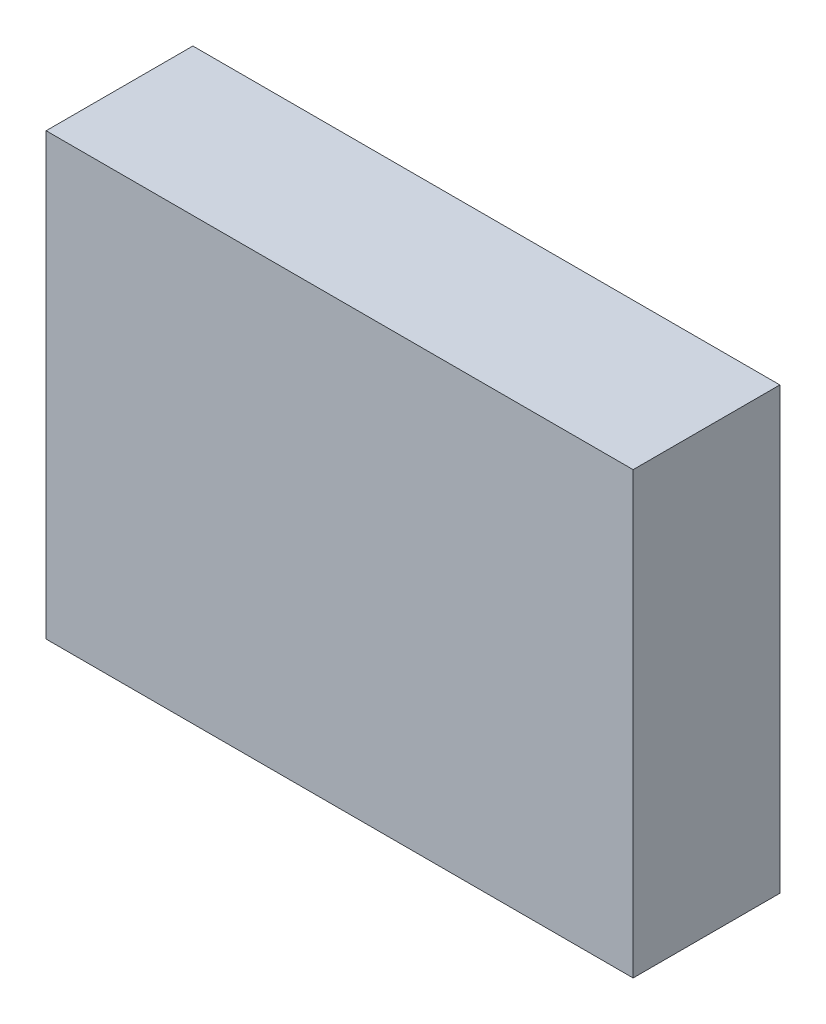
from build123d import *

# Parameters (mm, degrees)
BOSS_EXTRUDE2_DEPTH             = 60
BOSS_EXTRUDE2_DEPTH_BACK        = 60
SKETCH1_W                       = 90
SKETCH1_H                       = 30
F_2_0MM_DOWEL_HOLE1_D           = 2
F_2_0MM_DOWEL_HOLE1_DEPTH       = 10
F_2_0MM_DOWEL_HOLE1_CSINK_D     = 2.05
F_2_0MM_DOWEL_HOLE1_CSINK_ANGLE = 90
F_2_0MM_DOWEL_HOLE1_TIP         = 0.600860619
F_2_0MM_DOWEL_HOLE2_D           = 2
F_2_0MM_DOWEL_HOLE2_DEPTH       = 10
F_2_0MM_DOWEL_HOLE2_CSINK_D     = 2.05
F_2_0MM_DOWEL_HOLE2_CSINK_ANGLE = 90
F_2_0MM_DOWEL_HOLE2_TIP         = 0.600860619


with BuildPart() as part:
    # Sketch1 → Boss-Extrude2 (new, two sides: drawn at the far end of the back side and taken through both)
    with BuildSketch(Plane.YZ.offset(-BOSS_EXTRUDE2_DEPTH_BACK)):
        with Locations((-45, 15)):
            Rectangle(SKETCH1_W, SKETCH1_H)
    extrude(amount=BOSS_EXTRUDE2_DEPTH + BOSS_EXTRUDE2_DEPTH_BACK)

    # Ø2.0mm Dowel Hole1
    with Locations(Plane(origin=(0, 0, 0), x_dir=(1, 0, 0), z_dir=(0, 0, -1))):
        with Locations((7.5, 29), (-7.5, 61), (-7.5, 29), (7.5, 61)):
            CounterSinkHole(F_2_0MM_DOWEL_HOLE1_D / 2, F_2_0MM_DOWEL_HOLE1_CSINK_D / 2, depth=F_2_0MM_DOWEL_HOLE1_DEPTH, counter_sink_angle=F_2_0MM_DOWEL_HOLE1_CSINK_ANGLE)
            with Locations((0, 0, -(F_2_0MM_DOWEL_HOLE1_DEPTH + F_2_0MM_DOWEL_HOLE1_TIP / 2))):  # 118° drill point
                Cone(0, F_2_0MM_DOWEL_HOLE1_D / 2, F_2_0MM_DOWEL_HOLE1_TIP, mode=Mode.SUBTRACT)

    # Ø2.0mm Dowel Hole2
    with Locations(Plane(origin=(0, 0, 0), x_dir=(1, 0, 0), z_dir=(0, 0, -1))):
        with Locations((-3, 2.5), (-3, 17.5), (3, 17.5), (3, 2.5)):
            CounterSinkHole(F_2_0MM_DOWEL_HOLE2_D / 2, F_2_0MM_DOWEL_HOLE2_CSINK_D / 2, depth=F_2_0MM_DOWEL_HOLE2_DEPTH, counter_sink_angle=F_2_0MM_DOWEL_HOLE2_CSINK_ANGLE)
            with Locations((0, 0, -(F_2_0MM_DOWEL_HOLE2_DEPTH + F_2_0MM_DOWEL_HOLE2_TIP / 2))):  # 118° drill point
                Cone(0, F_2_0MM_DOWEL_HOLE2_D / 2, F_2_0MM_DOWEL_HOLE2_TIP, mode=Mode.SUBTRACT)


solid = part.part
